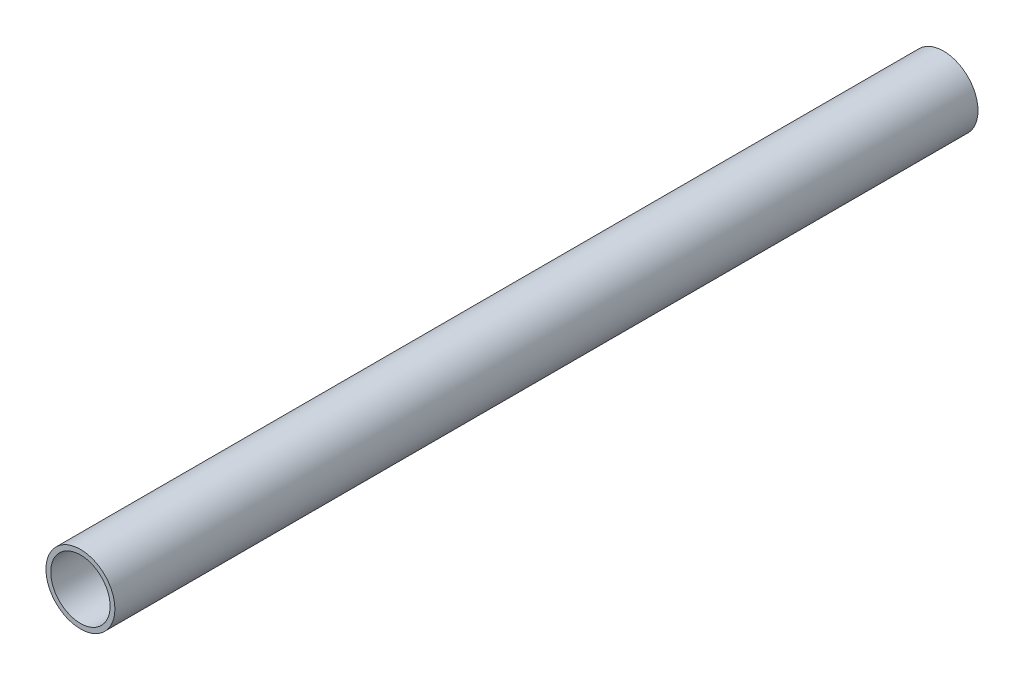
from build123d import *

# Parameters (mm, degrees)
SKETCH_1_R      = 7.55
SKETCH_1_R_2    = 6.5
EXTRUDE_1_DEPTH = 189


with BuildPart() as part:
    # 草图1 → 凸台-拉伸1 (new body)
    with BuildSketch(Plane.XY):
        Circle(SKETCH_1_R)
        Circle(SKETCH_1_R_2, mode=Mode.SUBTRACT)
    extrude(amount=EXTRUDE_1_DEPTH)


solid = part.part
